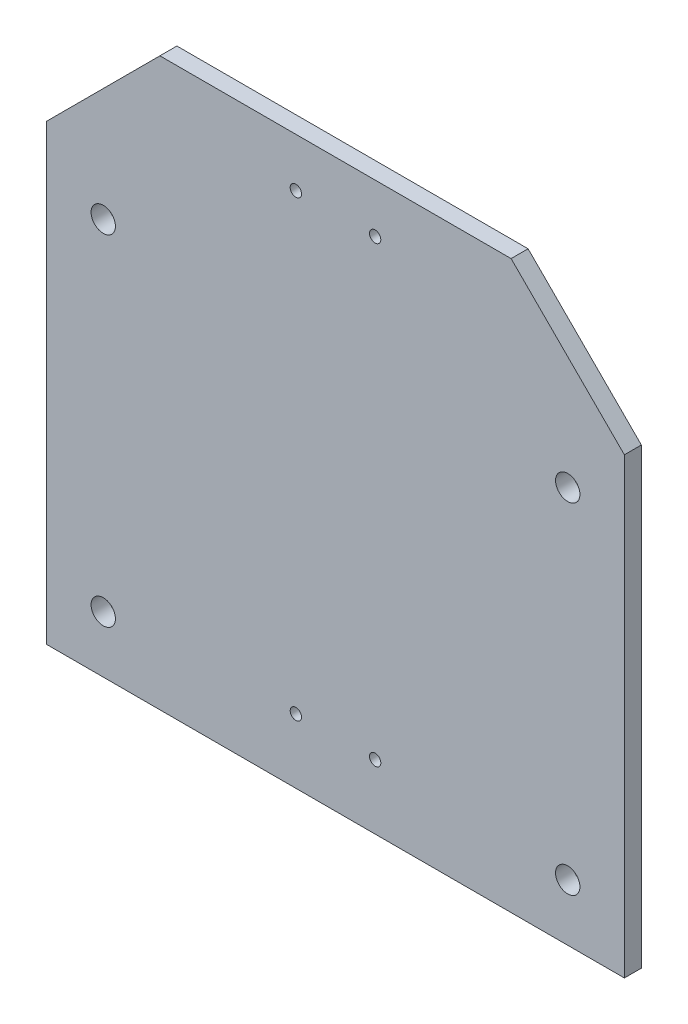
from build123d import *

# Parameters (mm, degrees)
EXTRUDE_1_DEPTH     = 3
SKETCH_2_R          = 2.15
CUT_EXTRUDE_1_DEPTH = 3
SKETCH_3_R          = 1
CUT_EXTRUDE_2_DEPTH = 70


with BuildPart() as part:
    # 草图1 → 凸台-拉伸1 (new body)
    with BuildSketch(Plane.XY):
        Polygon((-51.0025, -60.127538713), (51.0025, -60.127538713), (51.0025, 19.872461287), (31.0025, 39.872461287), (-31.0025, 39.872461287), (-51.0025, 19.872461287), align=None)
    extrude(amount=-EXTRUDE_1_DEPTH)

    # 草图2 → 切除-拉伸1 (cut)
    with BuildSketch(Plane.XY):
        with Locations((-41.0025, 9.872461287)):
            Circle(SKETCH_2_R)
        with Locations((-41.0025, -50.127538713)):
            Circle(SKETCH_2_R)
        with Locations((41.0025, 9.872461287)):
            Circle(SKETCH_2_R)
        with Locations((41.0025, -50.127538713)):
            Circle(SKETCH_2_R)
    extrude(amount=-CUT_EXTRUDE_1_DEPTH, mode=Mode.SUBTRACT)

    # 草图3 → 切除-拉伸2 (cut)
    with BuildSketch(Plane(origin=(0, 0, -3), x_dir=(-1, 0, 0), z_dir=(0, 0, -1))):
        with Locations((-7.000166, 31.25)):
            Circle(SKETCH_3_R)
        with Locations((6.999834, 31.25)):
            Circle(SKETCH_3_R)
        with Locations((-7.000166, -48.75)):
            Circle(SKETCH_3_R)
        with Locations((6.999834, -48.75)):
            Circle(SKETCH_3_R)
    extrude(amount=-CUT_EXTRUDE_2_DEPTH, mode=Mode.SUBTRACT)


solid = part.part
